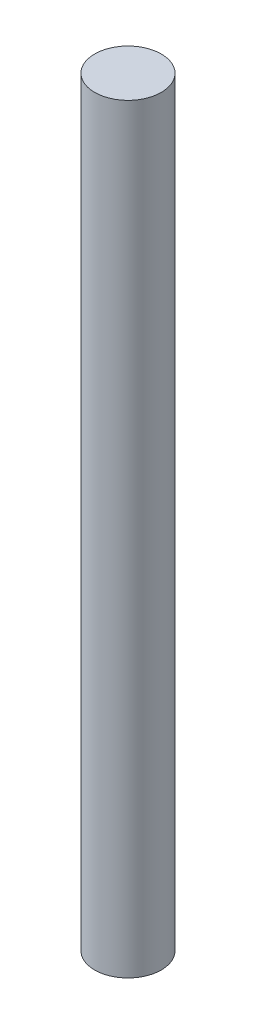
from build123d import *

# Parameters (mm, degrees)
SKETCH1_R           = 3.78
BOSS_EXTRUDE1_DEPTH = 86.3


with BuildPart() as part:
    # Sketch1 → Boss-Extrude1 (new body)
    with BuildSketch(Plane(origin=(0, 0, 0), x_dir=(1, 0, 0), z_dir=(0, 1, 0))):
        with Locations(Location((0, 0, 0), (0, 0, 270))):
            Circle(SKETCH1_R)
    extrude(amount=BOSS_EXTRUDE1_DEPTH)


solid = part.part
